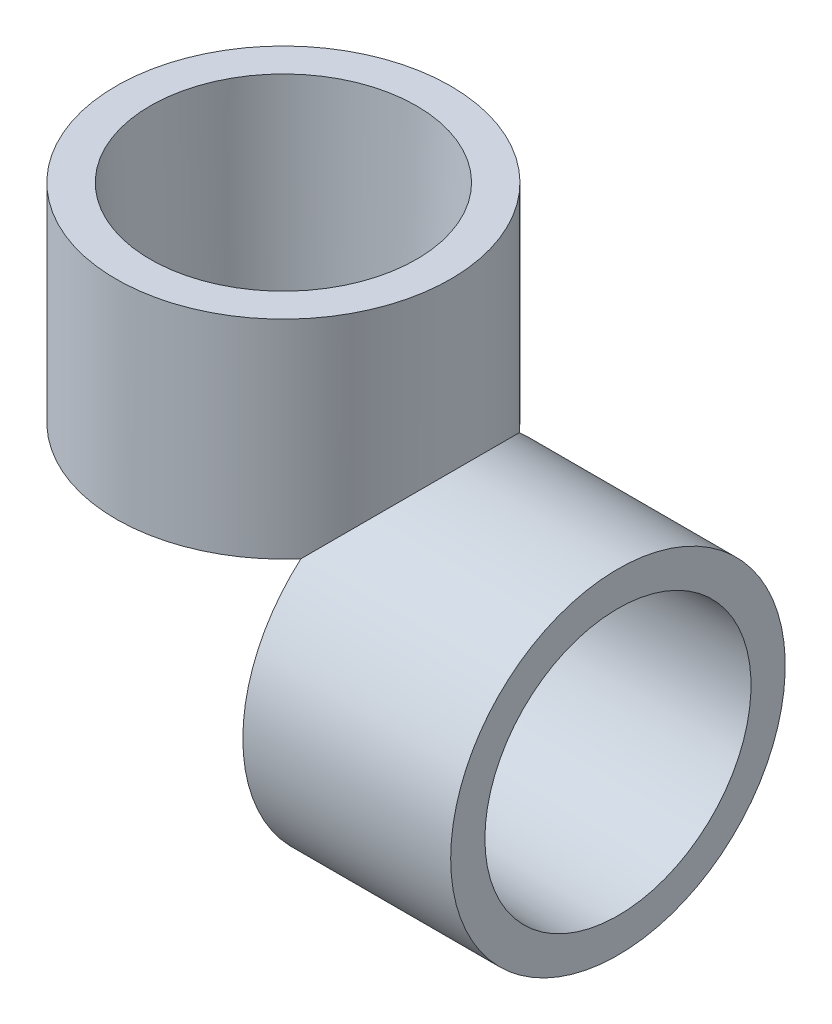
from build123d import *


with BuildPart() as part:
    # Sketch1 → Revolve1 (revolve)
    with BuildSketch(Plane.XY, mode=Mode.PRIVATE) as revolve1_sk:
        Polygon((12.7, -12.6873), (33.528, -13.335), (33.528, -16.764), (12.7, -16.764), align=None)
    revolve(revolve1_sk.sketch.rotate(Axis((-22.402366391, 0, 0), (1, 0, 0)), 270), axis=Axis((-22.402366391, 0, 0), (1, 0, 0)))

    # Sketch2 → Revolve2 (revolve)
    with BuildSketch(Plane.XY, mode=Mode.PRIVATE) as revolve2_sk:
        Polygon((-16.764, 33.528), (-16.764, 12.7), (-12.6873, 12.7), (-13.335, 33.528), align=None)
    revolve(revolve2_sk.sketch.rotate(Axis((0, 0, 0), (0, 1, 0)), 270), axis=Axis((0, 0, 0), (0, 1, 0)))


solid = part.part
